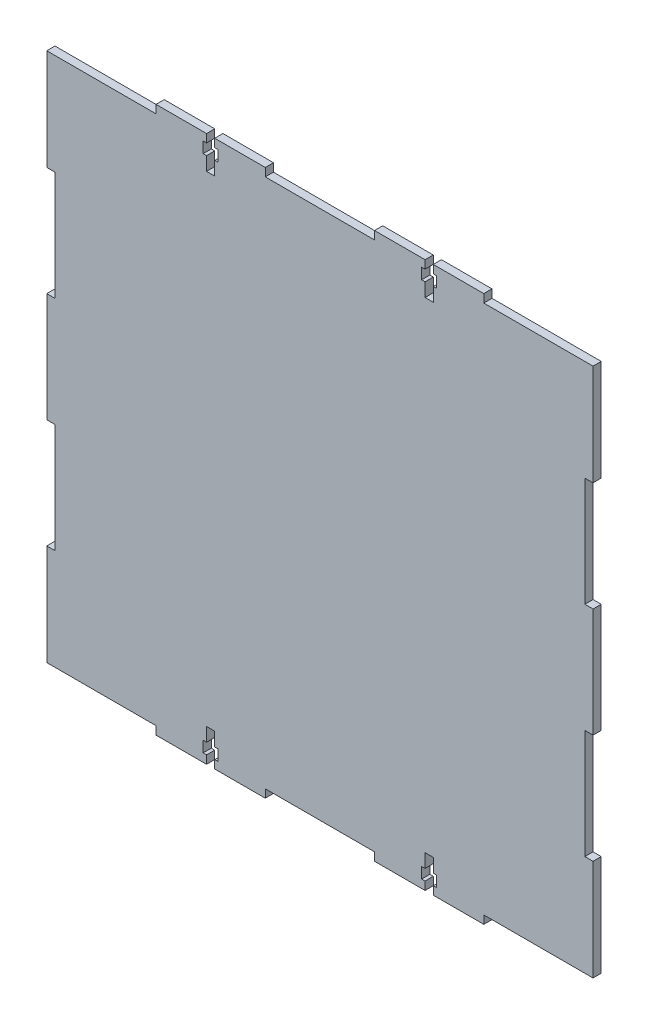
from build123d import *

# Parameters (mm, degrees)
EXTRUDE_1_DEPTH = 3


with BuildPart() as part:
    # 草图1 → 凸台-拉伸1 (new body)
    with BuildSketch(Plane.XY):
        Polygon((120, -3), (80, -3), (80, 0), (61.5, 0), (61.5, -3), (62.75, -3), (62.75, -7), (61.5, -7), (61.5, -12), (58.5, -12), (58.5, -7), (57.25, -7), (57.25, -3), (58.5, -3), (58.5, 0), (40, 0), (40, -3), (0, -3), (0, -40), (3, -40), (3, -80), (0, -80), (0, -120), (3, -120), (3, -160), (0, -160), (0, -197), (40, -197), (40, -200), (58.5, -200), (58.5, -197), (57.25, -197), (57.25, -193), (58.5, -193), (58.5, -188), (61.5, -188), (61.5, -193), (62.75, -193), (62.75, -197), (61.5, -197), (61.5, -200), (80, -200), (80, -197), (120, -197), (120, -200), (138.5, -200), (138.5, -197), (137.25, -197), (137.25, -193), (138.5, -193), (138.5, -188), (141.5, -188), (141.5, -193), (142.75, -193), (142.75, -197), (141.5, -197), (141.5, -200), (160, -200), (160, -197), (200, -197), (200, -160), (197, -160), (197, -120), (200, -120), (200, -80), (197, -80), (197, -40), (200, -40), (200, -3), (160, -3), (160, 0), (141.5, 0), (141.5, -3), (142.75, -3), (142.75, -7), (141.5, -7), (141.5, -12), (138.5, -12), (138.5, -7), (137.25, -7), (137.25, -3), (138.5, -3), (138.5, 0), (120, 0), align=None)
    extrude(amount=EXTRUDE_1_DEPTH)


solid = part.part
